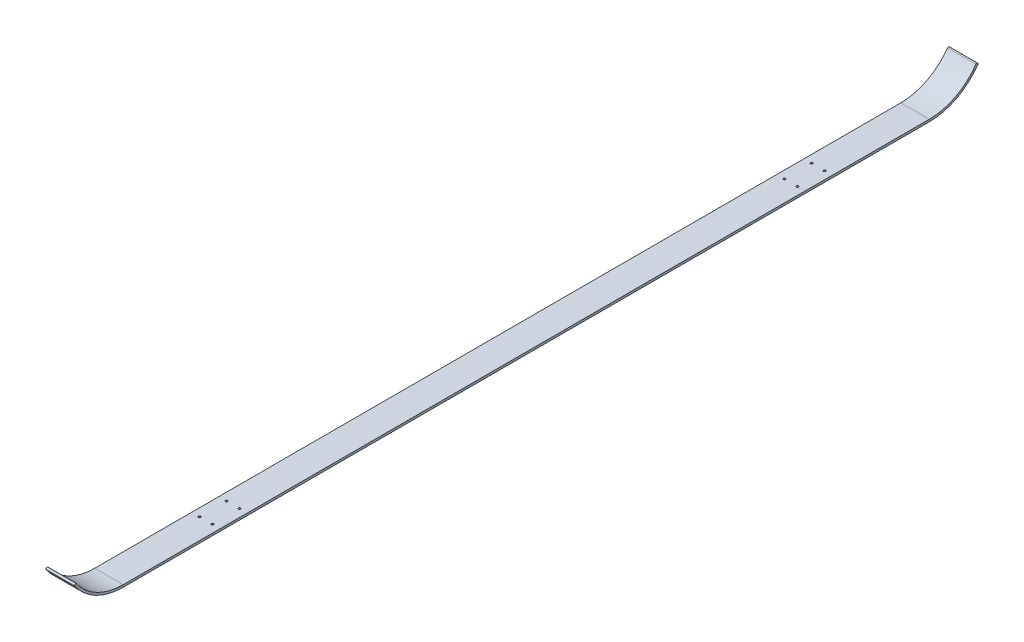
from build123d import *

# Parameters (mm, degrees)
SKETCH1_W           = 150
SKETCH1_H           = 4048
SKETCH1_R           = 6
BOSS_EXTRUDE1_DEPTH = 12
BOSS_EXTRUDE2_DEPTH = 150


with BuildPart() as part:
    # Sketch1 → Boss-Extrude1 (new body)
    with BuildSketch(Plane(origin=(0, 0, 0), x_dir=(1, 0, 0), z_dir=(0, 1, 0))):
        Rectangle(SKETCH1_W, SKETCH1_H)
        with Locations(Location((-34.25, 1470.25, 0), (0, 0, 270))):
            Circle(SKETCH1_R, mode=Mode.SUBTRACT)
        with Locations(Location((34.25, 1470.25, 0), (0, 0, 270))):
            Circle(SKETCH1_R, mode=Mode.SUBTRACT)
        with Locations(Location((-34.25, 1612.75, 0), (0, 0, 270))):
            Circle(SKETCH1_R, mode=Mode.SUBTRACT)
        with Locations(Location((34.25, 1612.75, 0), (0, 0, 270))):
            Circle(SKETCH1_R, mode=Mode.SUBTRACT)
        with Locations(Location((34.25, -1470.25, 0), (0, 0, 90))):
            Circle(SKETCH1_R, mode=Mode.SUBTRACT)
        with Locations(Location((-34.25, -1470.25, 0), (0, 0, 90))):
            Circle(SKETCH1_R, mode=Mode.SUBTRACT)
        with Locations(Location((34.25, -1612.75, 0), (0, 0, 90))):
            Circle(SKETCH1_R, mode=Mode.SUBTRACT)
        with Locations(Location((-34.25, -1612.75, 0), (0, 0, 90))):
            Circle(SKETCH1_R, mode=Mode.SUBTRACT)
    extrude(amount=BOSS_EXTRUDE1_DEPTH)

    # Sketch2 → Boss-Extrude2 (add)
    with BuildSketch(Plane(origin=(75, 0, 0), x_dir=(0, 0, -1), z_dir=(1, 0, 0))):
        with BuildLine():
            Line((-2024, 0), (-2124, 0))
            ThreePointArc((-2124, 0), (-2268.065567329, 35.252620048), (-2379.575437818, 133.044151858))
            ThreePointArc((-2379.575437818, 133.044151858), (-2378.101984171, 141.400522742), (-2369.745613287, 139.927069095))
            ThreePointArc((-2369.745613287, 139.927069095), (-2262.524583971, 45.896750047), (-2124, 12))
            Line((-2124, 12), (-2024, 12))
            Line((-2024, 12), (-2024, 0))
        make_face()
        with BuildLine():
            Line((2024, 12), (2124, 12))
            ThreePointArc((2124, 12), (2262.524583971, 45.896750047), (2369.745613287, 139.927069095))
            ThreePointArc((2369.745613287, 139.927069095), (2378.101984171, 141.400522742), (2379.575437818, 133.044151858))
            ThreePointArc((2379.575437818, 133.044151858), (2268.065567329, 35.252620048), (2124, 0))
            Line((2124, 0), (2024, 0))
            Line((2024, 0), (2024, 12))
        make_face()
    extrude(amount=-BOSS_EXTRUDE2_DEPTH)


solid = part.part
